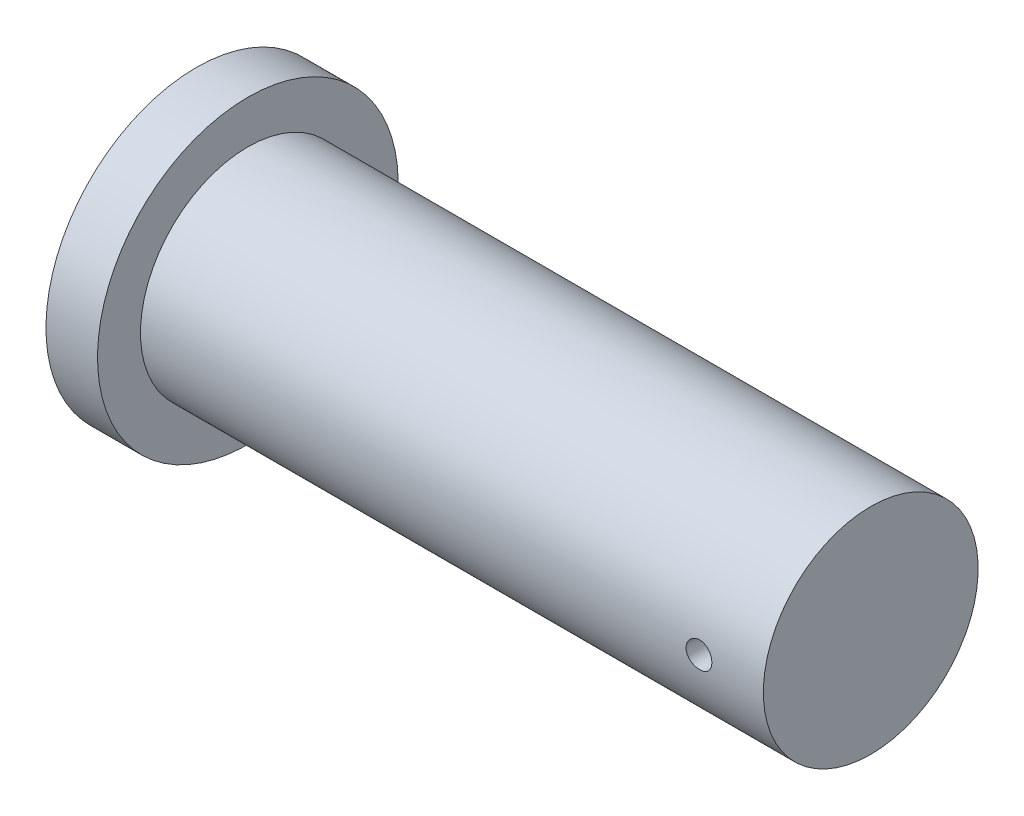
from build123d import *

# Parameters (mm, degrees)
CUT_EXTRUDE1_DEPTH      = 165.61773902
CUT_EXTRUDE1_DEPTH_BACK = 165.61773902
SKETCH2_R               = 3


with BuildPart() as part:
    # Sketch1 → Revolve1 (revolve)
    with BuildSketch(Plane.XY):
        Polygon((0, 0), (-157, 0), (-157, 35), (-145, 35), (-145, 25), (0, 25), align=None)
    revolve(axis=Axis((0, 0, 0), (-1, 0, 0)))

    # Sketch2 → Cut-Extrude1 (cut, two sides: drawn at the far end of the back side and taken through both)
    with BuildSketch(Plane.XY.offset(-CUT_EXTRUDE1_DEPTH_BACK)):
        with Locations((-15, 0)):
            Circle(SKETCH2_R)
    extrude(amount=CUT_EXTRUDE1_DEPTH + CUT_EXTRUDE1_DEPTH_BACK, mode=Mode.SUBTRACT)


solid = part.part
